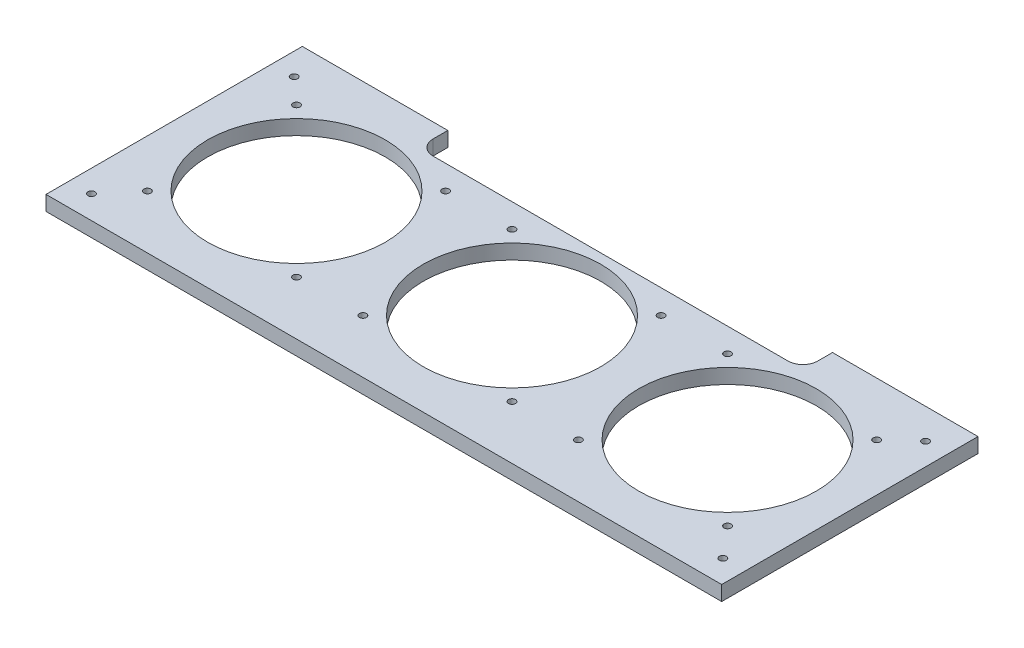
from build123d import *

# Parameters (mm, degrees)
SKETCH1_W           = 145
SKETCH1_H           = 55
BOSS_EXTRUDE1_DEPTH = 3.175
SKETCH4_R           = 0.75
SKETCH4_R_2         = 19.05
CUT_EXTRUDE1_DEPTH  = 156.113122027


with BuildPart() as part:
    # Sketch1 → Boss-Extrude1 (new body)
    with BuildSketch(Plane(origin=(0, 0, 0), x_dir=(1, 0, 0), z_dir=(0, 1, 0))):
        with Locations((72.5, 27.5)):
            Rectangle(SKETCH1_W, SKETCH1_H)
    extrude(amount=BOSS_EXTRUDE1_DEPTH)

    # Sketch4 → Cut-Extrude1 (cut, through all)
    with BuildSketch(Plane.XZ):
        with Locations((10.25, -11.5)):
            Circle(SKETCH4_R)
        with Locations((10.25, -43.5)):
            Circle(SKETCH4_R)
        with Locations((42.25, -43.5)):
            Circle(SKETCH4_R)
        with Locations((26.25, -27.5)):
            Circle(SKETCH4_R_2)
        with Locations((42.25, -11.5)):
            Circle(SKETCH4_R)
        with Locations((56.5, -11.5)):
            Circle(SKETCH4_R)
        with Locations((56.5, -43.5)):
            Circle(SKETCH4_R)
        with Locations((88.5, -43.5)):
            Circle(SKETCH4_R)
        with Locations((88.5, -11.5)):
            Circle(SKETCH4_R)
        with Locations((72.5, -27.5)):
            Circle(SKETCH4_R_2)
        with Locations((102.75, -11.5)):
            Circle(SKETCH4_R)
        with Locations((102.75, -43.5)):
            Circle(SKETCH4_R)
        with Locations((134.75, -43.5)):
            Circle(SKETCH4_R)
        with Locations((134.75, -11.5)):
            Circle(SKETCH4_R)
        with Locations((118.75, -27.5)):
            Circle(SKETCH4_R_2)
        with Locations((4.750000369, -48.50000744)):
            Circle(SKETCH4_R)
        with Locations((4.749998796, -5.00000808)):
            Circle(SKETCH4_R)
        with Locations((140.249999576, -5.00000318)):
            Circle(SKETCH4_R)
        with Locations((140.250001149, -48.50000254)):
            Circle(SKETCH4_R)
        with BuildLine():
            Line((113.775, -51.825), (113.775, -55))
            Line((113.775, -55), (31.225, -55))
            Line((31.225, -55), (31.225, -51.825))
            ThreePointArc((31.225, -51.825), (32.15493597, -49.57993597), (34.4, -48.65))
            Line((34.4, -48.65), (110.6, -48.65))
            ThreePointArc((110.6, -48.65), (112.84506403, -49.57993597), (113.775, -51.825))
        make_face()
    extrude(amount=-CUT_EXTRUDE1_DEPTH, mode=Mode.SUBTRACT)


solid = part.part
